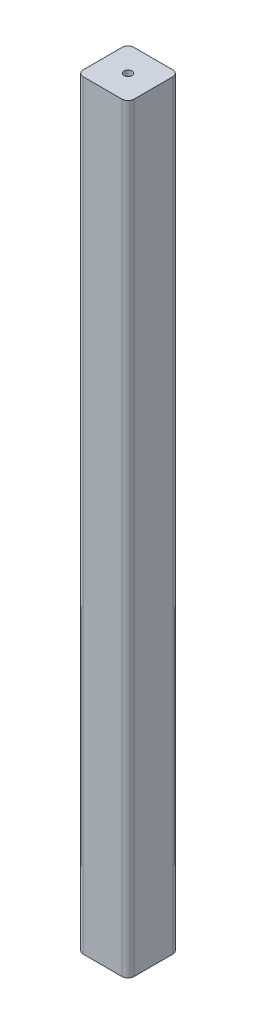
from build123d import *

# Parameters (mm, degrees)
SKETCH1_R           = 2
BOSS_EXTRUDE1_DEPTH = 380


with BuildPart() as part:
    # Sketch1 → Boss-Extrude1 (new body)
    with BuildSketch(Plane(origin=(0, 0, 0), x_dir=(1, 0, 0), z_dir=(0, 1, 0))):
        with BuildLine():
            Line((3, 0), (22.4, 0))
            ThreePointArc((22.4, 0), (24.521320344, 0.878679656), (25.4, 3))
            Line((25.4, 3), (25.4, 22.4))
            ThreePointArc((25.4, 22.4), (24.521320344, 24.521320344), (22.4, 25.4))
            Line((22.4, 25.4), (3, 25.4))
            ThreePointArc((3, 25.4), (0.878679656, 24.521320344), (0, 22.4))
            Line((0, 22.4), (0, 3))
            ThreePointArc((0, 3), (0.878679656, 0.878679656), (3, 0))
        make_face()
        with Locations(Location((12.7, 12.7, 0), (0, 0, 270))):
            Circle(SKETCH1_R, mode=Mode.SUBTRACT)
    extrude(amount=BOSS_EXTRUDE1_DEPTH)


solid = part.part
